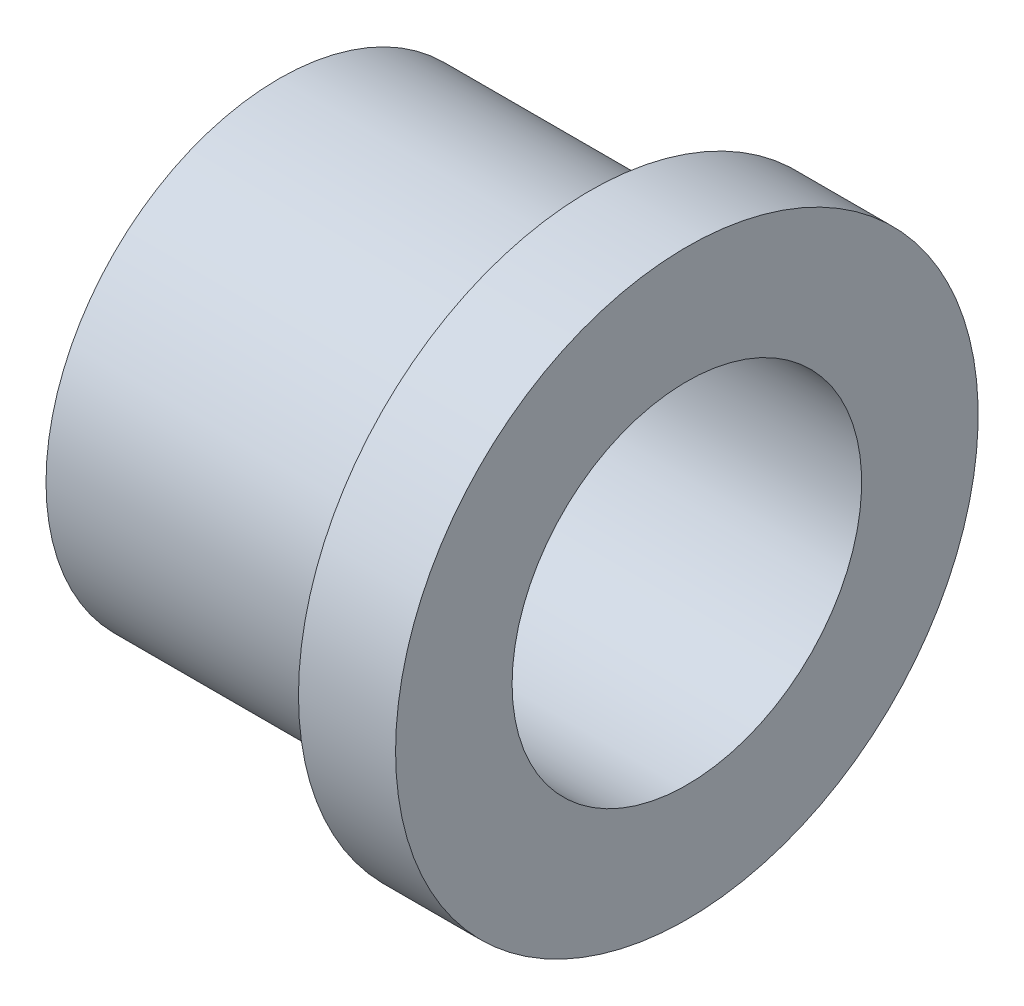
from build123d import *


with BuildPart() as part:
    # Sketch1 → Revolve1 (revolve)
    with BuildSketch(Plane(origin=(0, 0, 0), x_dir=(1, 0, 0), z_dir=(0, 1, 0)), mode=Mode.PRIVATE) as revolve1_sk:
        Polygon((0, 12), (16, 12), (16, 15), (21, 15), (21, 9), (0, 9), align=None)
    revolve(revolve1_sk.sketch.rotate(Axis((0, 0, 0), (1, 0, 0)), 180), axis=Axis((0, 0, 0), (1, 0, 0)))


solid = part.part
